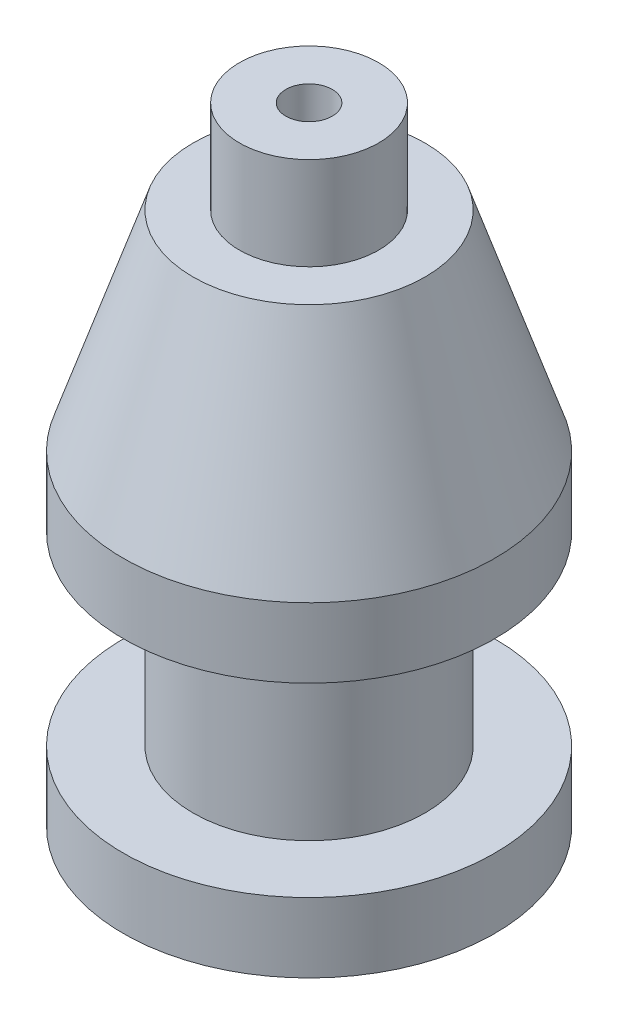
from build123d import *


with BuildPart() as part:
    # Sketch1 → Revolve1 (revolve)
    with BuildSketch(Plane.XY, mode=Mode.PRIVATE) as revolve1_sk:
        Polygon((10, 270), (10, 0), (80, 0), (80, 30), (50, 30), (50, 110), (80, 110), (80, 140), (50, 230), (30, 230), (30, 270), align=None)
    revolve(revolve1_sk.sketch.rotate(Axis((0, 0, 0), (0, 1, 0)), 90), axis=Axis((0, 0, 0), (0, 1, 0)))


solid = part.part
